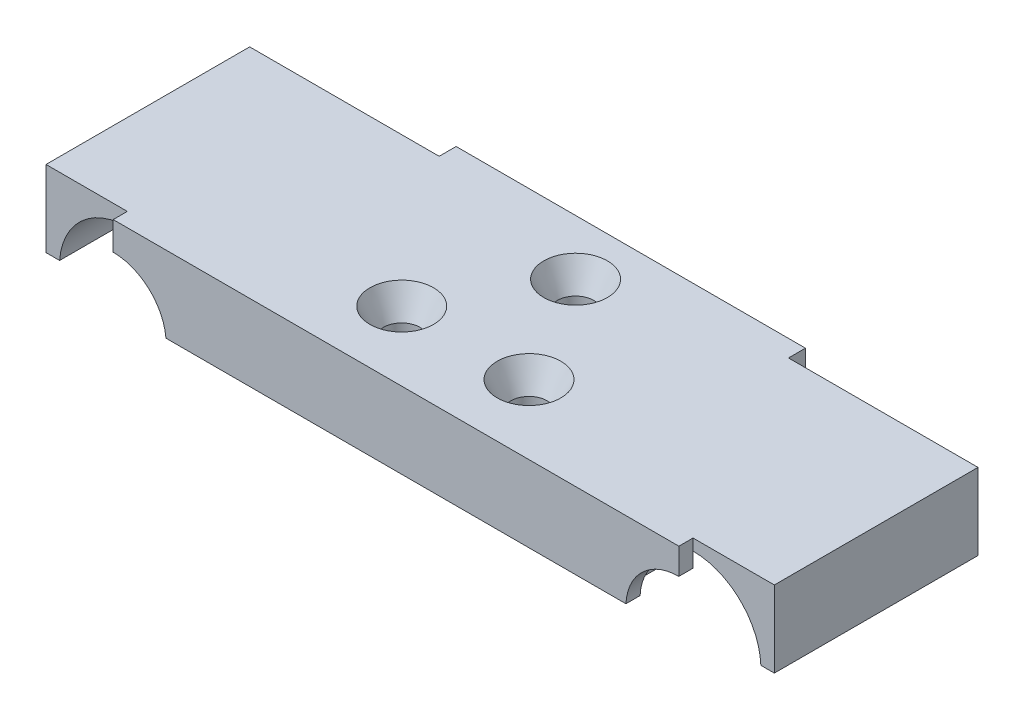
from build123d import *

# Parameters (mm, degrees)
BOSS_EXTRUDE1_DEPTH                               = 7.112
SKETCH2_R                                         = 4.7625
CUT_EXTRUDE1_DEPTH                                = 39.891507997
SKETCH3_R                                         = 6.096
CUT_EXTRUDE2_DEPTH                                = 10.668
CSK_FOR_4_FLAT_HEAD_MACHINE_SCREW_100_D           = 3.2639
CSK_FOR_4_FLAT_HEAD_MACHINE_SCREW_100_CSINK_D     = 5.715
CSK_FOR_4_FLAT_HEAD_MACHINE_SCREW_100_CSINK_ANGLE = 52.893588
BOSS_EXTRUDE2_START                               = 1.27
BOSS_EXTRUDE2_DEPTH                               = 1.27
SKETCH12_W                                        = 65.405
SKETCH12_H                                        = 0.254
CUT_EXTRUDE3_DEPTH                                = 40.553568414


with BuildPart() as part:
    # Sketch1 → Boss-Extrude1 (new body)
    with BuildSketch(Plane(origin=(0, 0, 0), x_dir=(1, 0, 0), z_dir=(0, 1, 0))):
        Polygon((32.7025, 0), (-32.7025, 0), (-32.7025, 18.288), (-15.6845, 18.288), (-15.6845, 19.812), (15.6845, 19.812), (15.6845, 18.288), (32.7025, 18.288), align=None)
    extrude(amount=BOSS_EXTRUDE1_DEPTH)

    # Sketch2 → Cut-Extrude1 (cut, through all)
    with BuildSketch(Plane.XY):
        with Locations((-25.4, -0.1905)):
            Circle(SKETCH2_R)
        with Locations((25.399642811, 0)):
            Circle(SKETCH2_R)
    extrude(amount=-CUT_EXTRUDE1_DEPTH, mode=Mode.SUBTRACT)

    # Sketch3 → Cut-Extrude2 (cut)
    with BuildSketch(Plane.XY):
        with Locations((-25.4, -0.1905)):
            Circle(SKETCH3_R)
        with Locations((25.399642811, 0)):
            Circle(SKETCH3_R)
    extrude(amount=-CUT_EXTRUDE2_DEPTH, mode=Mode.SUBTRACT)

    # CSK for #4 Flat Head Machine Screw (100)1 (through all)
    with Locations(Plane(origin=(0, 7.112, 0), x_dir=(1, 0, 0), z_dir=(0, 1, 0))):
        with Locations((0, 14.855335183), (-5.715, 4.956664817), (5.715, 4.956664817)):
            CounterSinkHole(CSK_FOR_4_FLAT_HEAD_MACHINE_SCREW_100_D / 2, CSK_FOR_4_FLAT_HEAD_MACHINE_SCREW_100_CSINK_D / 2, counter_sink_angle=CSK_FOR_4_FLAT_HEAD_MACHINE_SCREW_100_CSINK_ANGLE)

    # Sketch11 → Boss-Extrude2 (add)
    with BuildSketch(Plane.XY.offset(BOSS_EXTRUDE2_START)):
        with BuildLine():
            Line((-20.641311525, 0), (20.637142811, 0))
            ThreePointArc((20.637142811, 0), (22.032046766, 3.367596045), (25.399642811, 4.7625))
            Line((25.399642811, 4.7625), (25.399642811, 7.112))
            Line((25.399642811, 7.112), (-25.4, 7.112))
            Line((-25.4, 7.112), (-25.4, 4.572))
            ThreePointArc((-25.4, 4.572), (-22.100443212, 3.24378759), (-20.641311525, 0))
        make_face()
    extrude(amount=-BOSS_EXTRUDE2_DEPTH)

    # Sketch12 → Cut-Extrude3 (cut, through all)
    with BuildSketch(Plane(origin=(0, 0, -19.812), x_dir=(-1, 0, 0), z_dir=(0, 0, -1))):
        with Locations((0, 0.127)):
            Rectangle(SKETCH12_W, SKETCH12_H)
    extrude(amount=-CUT_EXTRUDE3_DEPTH, mode=Mode.SUBTRACT)


solid = part.part
